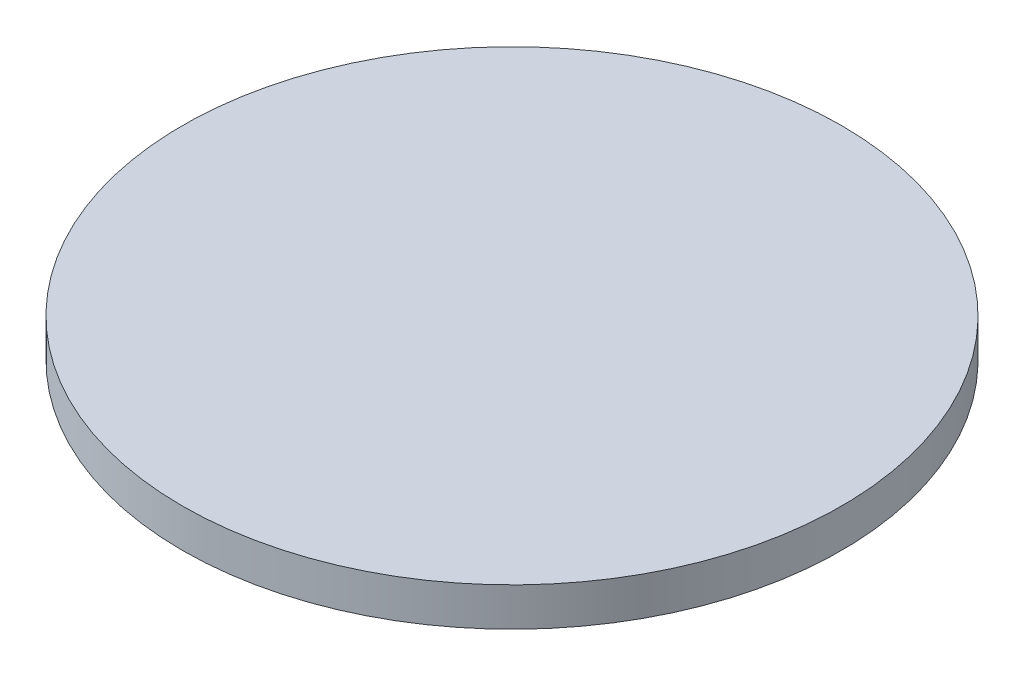
from build123d import *

# Parameters (mm, degrees)
SKETCH1_R           = 60
BOSS_EXTRUDE1_DEPTH = 7


with BuildPart() as part:
    # Sketch1 → Boss-Extrude1 (new body)
    with BuildSketch(Plane(origin=(0, 0, 0), x_dir=(1, 0, 0), z_dir=(0, 1, 0))):
        with Locations(Location((0, 0, 0), (0, 0, 270))):
            Circle(SKETCH1_R)
    extrude(amount=BOSS_EXTRUDE1_DEPTH)


solid = part.part
